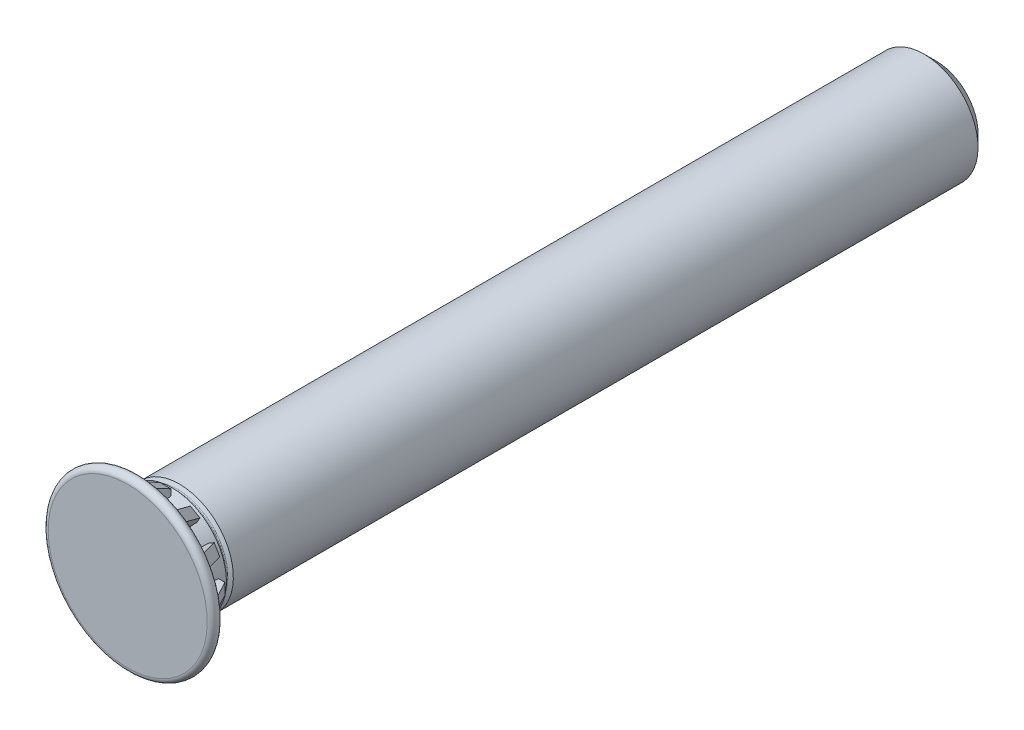
from build123d import *

# Parameters (mm, degrees)
FILLET2_R           = 0.04375
SKETCH16_R          = 1.507448052
CUT_EXTRUDE3_DEPTH  = 0.175
CUT_EXTRUDE3_DRAFT  = -30
BOSS_EXTRUDE1_DEPTH = 0.20475
CIRPATTERN3_COUNT   = 12
SKETCH14_R          = 2.320854115
BOSS_EXTRUDE3_DEPTH = 0.15


with BuildPart() as part:
    # Sketch7 → Revolve3 (revolve)
    with BuildSketch(Plane(origin=(0, 0, 0), x_dir=(0, 0, -1), z_dir=(1, 0, 0))):
        with BuildLine():
            Line((15, 1.545336663), (14.545336663, 2))
            Line((14.545336663, 2), (-13.0815625, 2))
            Line((-13.0815625, 2), (-13.1690625, 1.848445554))
            Line((-13.1690625, 1.848445554), (-13.2565625, 1.848445554))
            Line((-13.2565625, 1.848445554), (-13.355, 2.018944306))
            Line((-13.355, 2.018944306), (-14.6, 1.848445554))
            Line((-14.6, 1.848445554), (-14.6, 2))
            Line((-14.6, 2), (-14.6, 2.95))
            ThreePointArc((-14.6, 2.95), (-14.8, 3.15), (-15, 2.95))
            Line((-15, 2.95), (-15, 0))
            Line((-15, 0), (15, 0))
            Line((15, 0), (15, 1.545336663))
        make_face()
    revolve(axis=Axis((0, 0, -15), (0, 0, 1)))

    # Fillet2
    fillet2_edges = [part.edges().sort_by_distance(p)[0] for p in [
        (0, -1.848445554, 13.2565625),
        (0, -1.848445554, 13.1690625),
    ]]
    fillet(fillet2_edges, radius=FILLET2_R)


with BuildPart() as cut_extrude3_tool:
    # Sketch16 → Cut-Extrude3 (with draft: the straight prism first)
    with BuildSketch(Plane(origin=(0, 0, -15), x_dir=(-1, 0, 0), z_dir=(0, 0, -1))):
        Circle(SKETCH16_R)
    extrude(amount=-CUT_EXTRUDE3_DEPTH)
    # Cut-Extrude3: the draft: its side faces are tilted about the plane it starts from
    cut_extrude3_sides = [cut_extrude3_tool.faces().sort_by_distance(p)[0] for p in [
        (1.507448052, 0, -14.9125),
    ]]
    draft(cut_extrude3_sides, Plane(origin=(0, 0, -15), x_dir=(-1, 0, 0), z_dir=(0, 0, -1)), CUT_EXTRUDE3_DRAFT)


with BuildPart() as part_1:
    add(part.part)

    # Cut-Extrude3: cut by cut_extrude3_tool
    add(cut_extrude3_tool.part, mode=Mode.SUBTRACT)

    # Cut-Extrude1 cone 1 section (through the dimple's axis) → Cut-Extrude1 (revolve, cut)
    with BuildSketch(Plane(origin=(0, 0, -14.825), x_dir=(0, 1, 0), z_dir=(1, 0, 0))):
        Polygon((0, 0), (0.5, 0), (0, 0.5), align=None)
    revolve(axis=Axis((0, 0, -14.825), (0, 0, 1)), mode=Mode.SUBTRACT)

    # Sketch9 → Boss-Extrude1 (add, symmetric)
    with BuildSketch(Plane(origin=(0, 0, 0), x_dir=(0, 0, -1), z_dir=(1, 0, 0))):
        Polygon((-14.6, 2.578726794), (-14.3, 2.578726794), (-13.6, 2.207453588), (-13.6, 0), (-14.6, 0), align=None)
    boss_extrude1 = extrude(amount=BOSS_EXTRUDE1_DEPTH, both=True)

    # CirPattern3: Boss-Extrude1 ×12 about axis
    cirpattern3_axis = Axis((0, 0, 0), (0, 0, 1))
    for i in range(1, CIRPATTERN3_COUNT):
        add(boss_extrude1.rotate(cirpattern3_axis, i * 360 / CIRPATTERN3_COUNT))

    # Sketch14 → Boss-Extrude3 (add)
    with BuildSketch(Plane(origin=(0, 0, 14.6), x_dir=(-1, 0, 0), z_dir=(0, 0, -1))):
        Circle(SKETCH14_R)
    extrude(amount=BOSS_EXTRUDE3_DEPTH)


solid = part_1.part
